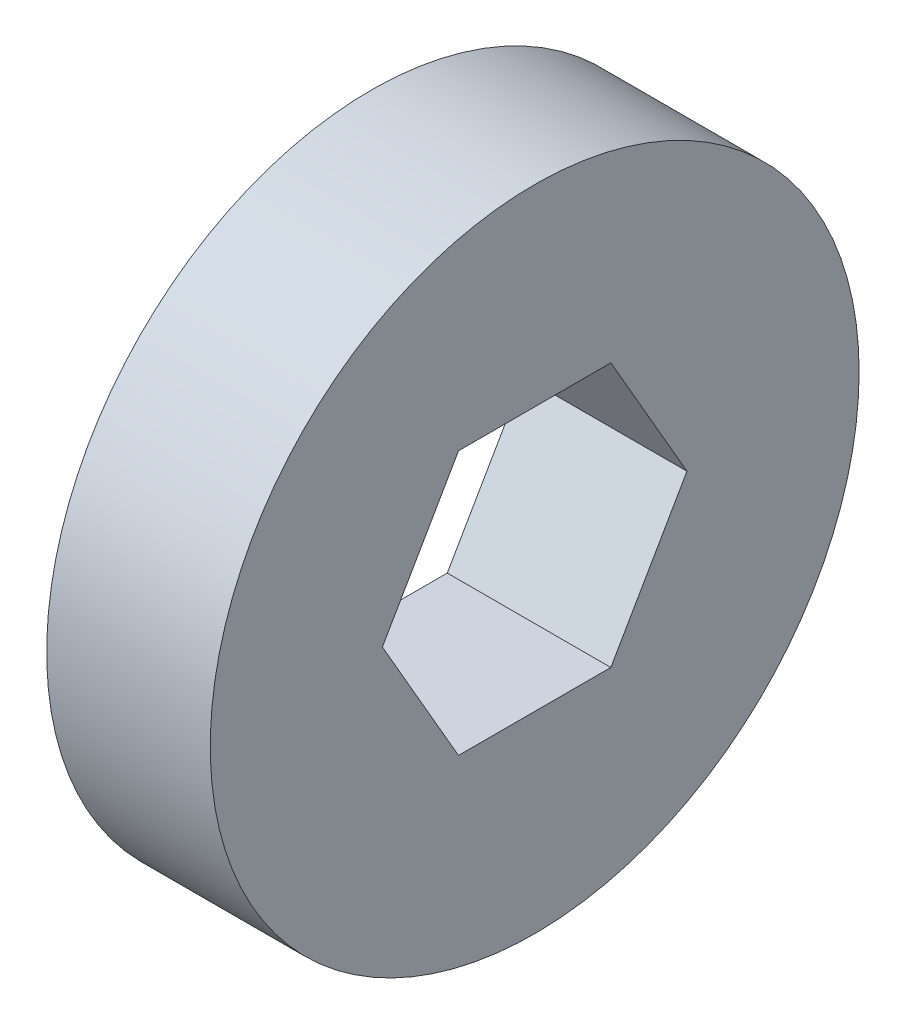
from build123d import *

# Parameters (mm, degrees)
SKETCH1_R           = 15.621
BOSS_EXTRUDE1_DEPTH = 7.874


with BuildPart() as part:
    # Sketch1 → Boss-Extrude1 (new body)
    with BuildSketch(Plane(origin=(0, 0, 0), x_dir=(0, 0, -1), z_dir=(1, 0, 0))):
        Circle(SKETCH1_R)
        Polygon((3.666174209, 6.35), (-3.666174209, 6.35), (-7.332348419, 0), (-3.666174209, -6.35), (3.666174209, -6.35), (7.332348419, 0), align=None, mode=Mode.SUBTRACT)
    extrude(amount=BOSS_EXTRUDE1_DEPTH)


solid = part.part
